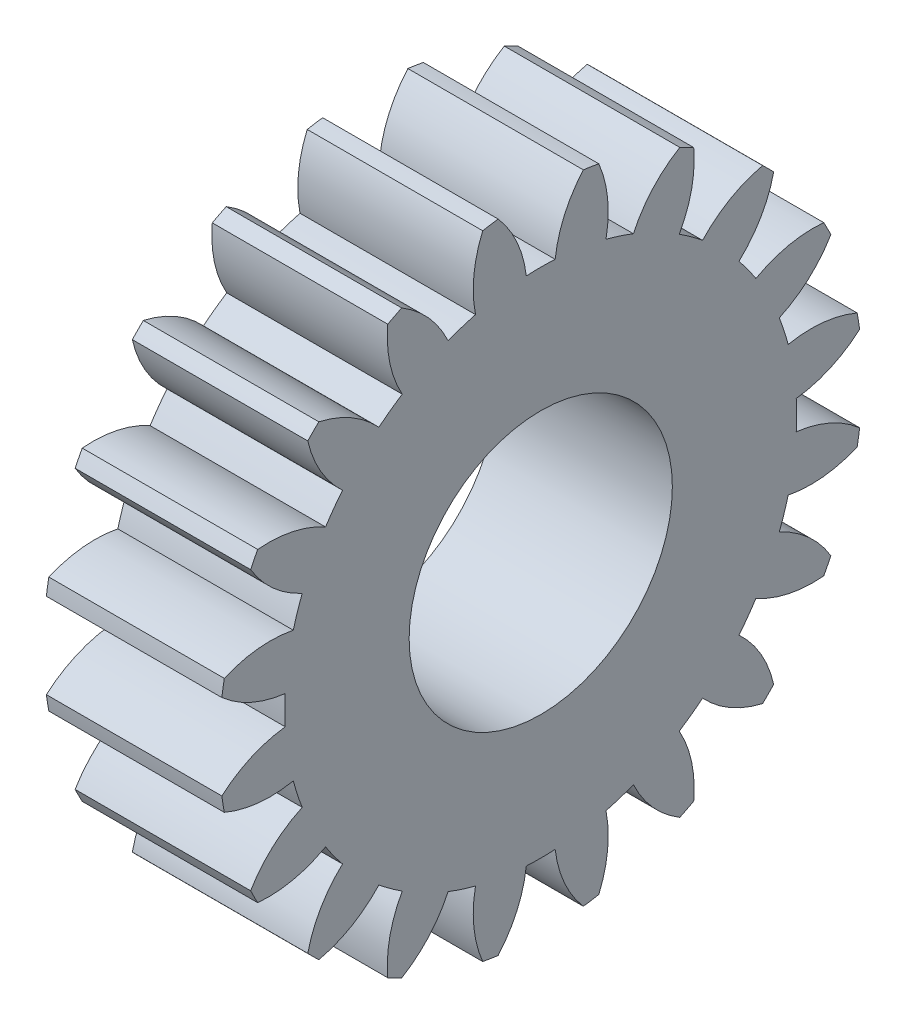
from build123d import *

# Parameters (mm, degrees)
BASPROSKE_W     = 12
BASPROSKE_H     = 22
TOOTHCUT_DEPTH  = 34.346664001
TEETHCUTS_COUNT = 20
TEETHCUTS_ANGLE = 342
BORSKE_R        = 9
BORE_DEPTH      = 50.0000508


with BuildPart() as part:
    # BasProSke → Base-Revolve (revolve)
    with BuildSketch(Plane(origin=(0, 0, 0), x_dir=(1, 0, 0), z_dir=(0, 1, 0)), mode=Mode.PRIVATE) as base_revolve_sk:
        with Locations((6, 11)):
            Rectangle(BASPROSKE_W, BASPROSKE_H)
    revolve(base_revolve_sk.sketch.rotate(Axis((-10, 0, 0), (1, 0, 0)), 180), axis=Axis((-10, 0, 0), (1, 0, 0)))

    # TooCutSke → ToothCut (cut, through all)
    with BuildSketch(Plane(origin=(0, 0, 0), x_dir=(0, 0, -1), z_dir=(1, 0, 0))):
        with BuildLine():
            ThreePointArc((0.986171591, 17.471189616), (0, 17.499), (-0.986171591, 17.471189616))
            ThreePointArc((-0.986171591, 17.471189616), (-1.626916196, 19.798789858), (-2.932850173, 21.829260982))
            ThreePointArc((-2.932850173, 21.829260982), (0, 22.0254), (2.932850173, 21.829260982))
            ThreePointArc((2.932850173, 21.829260982), (1.626916196, 19.798789858), (0.986171591, 17.471189616))
        make_face()
    toothcut = extrude(amount=TOOTHCUT_DEPTH, mode=Mode.SUBTRACT)

    # TeethCuts: ToothCut ×20 about axis
    teethcuts_axis = Axis((-10, 0, 0), (1, 0, 0))
    for i in range(1, TEETHCUTS_COUNT):
        add(toothcut.rotate(teethcuts_axis, i * TEETHCUTS_ANGLE / (TEETHCUTS_COUNT - 1)), mode=Mode.SUBTRACT)

    # BorSke → Bore (cut, symmetric)
    with BuildSketch(Plane(origin=(0, 0, 0), x_dir=(0, 0, -1), z_dir=(1, 0, 0))):
        with Locations(Location((0, 0, 0), (0, 0, 180))):
            Circle(BORSKE_R)
    extrude(amount=BORE_DEPTH, both=True, mode=Mode.SUBTRACT)


solid = part.part
